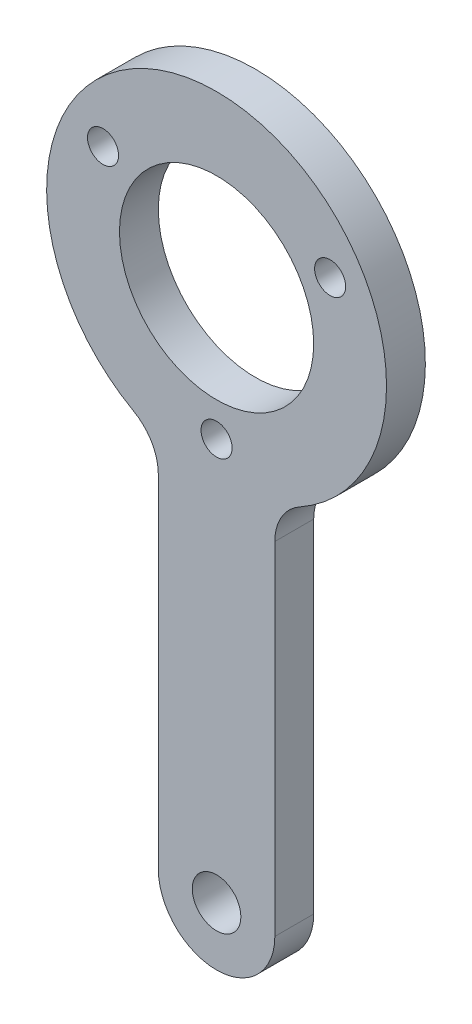
from build123d import *

# Parameters (mm, degrees)
EXTRUDE_1_DEPTH     = 4
SKETCH_3_R          = 2.5
CUT_EXTRUDE_1_DEPTH = 24
SKETCH_4_R          = 1.525
CUT_EXTRUDE_2_DEPTH = 5
SKETCH_5_R          = 2.5
CUT_EXTRUDE_3_DEPTH = 5
FILLET_1_R          = 5
SKETCH_6_R          = 1.6
SKETCH_6_R_2        = 10
CUT_EXTRUDE_4_DEPTH = 10
SKETCH_7_R          = 17.5
SKETCH_7_R_2        = 10
SKETCH_7_R_3        = 1.6
EXTRUDE_2_DEPTH     = 4
FILLET_2_R          = 5
EXTRUDE_START       = -4
SKETCH_8_R          = 2.5
EXTRUDE_3_DEPTH     = 4
SKETCH_9_R          = 2.5
EXTRUDE_4_DEPTH     = 4


with BuildPart() as part:
    # 草图1 → 凸台-拉伸1 (new body)
    with BuildSketch(Plane.XY):
        with BuildLine():
            Line((6, -7.365459931), (6, -45))
            ThreePointArc((6, -45), (0, -51), (-6, -45))
            Line((-6, -45), (-6, -7.365459931))
            ThreePointArc((-6, -7.365459931), (0, 9.5), (6, -7.365459931))
        make_face()
    extrude(amount=EXTRUDE_1_DEPTH)

    # 草图3 → 切除-拉伸1 (cut)
    with BuildSketch(Plane.XY.offset(4)):
        with Locations((0, -45)):
            Circle(SKETCH_3_R)
    extrude(amount=-CUT_EXTRUDE_1_DEPTH, mode=Mode.SUBTRACT)

    # 草图4 → 切除-拉伸2 (cut)
    with BuildSketch(Plane.XY.offset(4)):
        with Locations((0, 6.25)):
            Circle(SKETCH_4_R)
        with Locations((0, -6.25)):
            Circle(SKETCH_4_R)
    extrude(amount=-CUT_EXTRUDE_2_DEPTH, mode=Mode.SUBTRACT)

    # 草图5 → 切除-拉伸3 (cut)
    with BuildSketch(Plane.XY.offset(4)):
        Circle(SKETCH_5_R)
    extrude(amount=-CUT_EXTRUDE_3_DEPTH, mode=Mode.SUBTRACT)

    # 圆角1
    fillet_1_edges = [part.edges().sort_by_distance(p)[0] for p in [
        (-6, -7.365459931, 2),
        (6, -7.365459931, 2),
    ]]
    fillet(fillet_1_edges, radius=FILLET_1_R)

    # 草图6 → 切除-拉伸4 (cut)
    with BuildSketch(Plane.XY.offset(4)):
        with Locations((0, -13.5)):
            Circle(SKETCH_6_R)
        Circle(SKETCH_6_R_2)
    extrude(amount=-CUT_EXTRUDE_4_DEPTH, mode=Mode.SUBTRACT)

    # 草图7 → 凸台-拉伸2 (add)
    with BuildSketch(Plane.XY.offset(4)):
        Circle(SKETCH_7_R)
        Circle(SKETCH_7_R_2, mode=Mode.SUBTRACT)
        with Locations((11.691342951, 6.75)):
            Circle(SKETCH_7_R_3, mode=Mode.SUBTRACT)
        with Locations((-11.691342951, 6.75)):
            Circle(SKETCH_7_R_3, mode=Mode.SUBTRACT)
        with Locations((0, -13.5)):
            Circle(SKETCH_7_R_3, mode=Mode.SUBTRACT)
    extrude(amount=-EXTRUDE_2_DEPTH)

    # 圆角2
    fillet_2_edges = [part.edges().sort_by_distance(p)[0] for p in [
        (6, -16.439282223, 2),
        (-6, -16.439282223, 2),
    ]]
    fillet(fillet_2_edges, radius=FILLET_2_R)

    # 草图8 → 凸台-拉伸3 (add)
    # profile 1 of 4: a face of its own
    with BuildSketch(Plane.XY.offset(4).offset(EXTRUDE_START)):
        with BuildLine():
            ThreePointArc((3.427769437, -49.924469178), (5.318205366, -52.071044966), (6, -54.848938357))
            Line((6, -54.848938357), (6, -45))
            ThreePointArc((6, -45), (5.318205366, -47.777893391), (3.427769437, -49.924469178))
        make_face()
    # profile 2 of 4: a face of its own
    with BuildSketch(Plane.XY.offset(4).offset(EXTRUDE_START)):
        with BuildLine():
            Line((-6, -45), (-6, -54.848938357))
            ThreePointArc((-6, -54.848938357), (-5.318205366, -52.071044966), (-3.427769437, -49.924469178))
            ThreePointArc((-3.427769437, -49.924469178), (-5.318205366, -47.777893391), (-6, -45))
        make_face()
    # profile 3 of 4: a face of its own
    with BuildSketch(Plane.XY.offset(4).offset(EXTRUDE_START)):
        with BuildLine():
            Line((-6, -40), (-6, -45))
            ThreePointArc((-6, -45), (-5.318205366, -47.777893391), (-3.427769437, -49.924469178))
            ThreePointArc((-3.427769437, -49.924469178), (0, -48.848938357), (3.427769437, -49.924469178))
            ThreePointArc((3.427769437, -49.924469178), (5.318205366, -47.777893391), (6, -45))
            Line((6, -45), (6, -40))
            Line((6, -40), (-6, -40))
        make_face()
        with Locations((0, -45)):
            Circle(SKETCH_8_R, mode=Mode.SUBTRACT)
    # profile 4 of 4: a face of its own
    with BuildSketch(Plane.XY.offset(4).offset(EXTRUDE_START)):
        with BuildLine():
            ThreePointArc((-3.427769437, -49.924469178), (-5.318205366, -52.071044966), (-6, -54.848938357))
            ThreePointArc((-6, -54.848938357), (0, -60.848938357), (6, -54.848938357))
            ThreePointArc((6, -54.848938357), (5.318205366, -52.071044966), (3.427769437, -49.924469178))
            ThreePointArc((3.427769437, -49.924469178), (0, -51), (-3.427769437, -49.924469178))
        make_face()
        with Locations((0, -54.848938357)):
            Circle(SKETCH_8_R, mode=Mode.SUBTRACT)
    extrude(amount=EXTRUDE_3_DEPTH)

    # 草图9 → 凸台-拉伸4 (add)
    with BuildSketch(Plane.XY.offset(4)):
        with Locations((0, -45)):
            Circle(SKETCH_9_R)
    extrude(amount=-EXTRUDE_4_DEPTH)


solid = part.part
